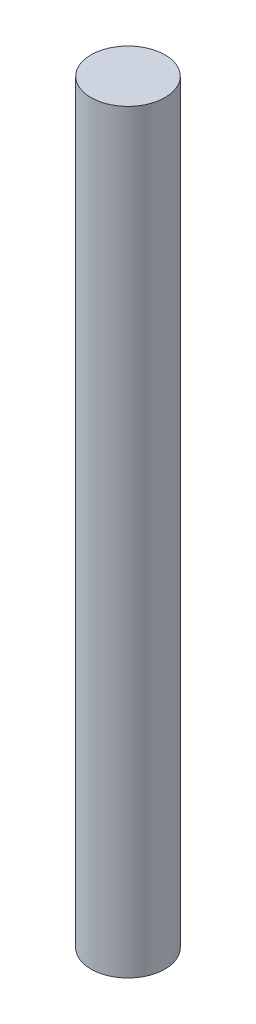
from build123d import *

# Parameters (mm, degrees)
SKETCH1_R           = 12.446
BOSS_EXTRUDE1_DEPTH = 254


with BuildPart() as part:
    # Sketch1 → Boss-Extrude1 (new body)
    with BuildSketch(Plane(origin=(0, 0, 0), x_dir=(1, 0, 0), z_dir=(0, 1, 0))):
        Circle(SKETCH1_R)
    extrude(amount=BOSS_EXTRUDE1_DEPTH)


solid = part.part
